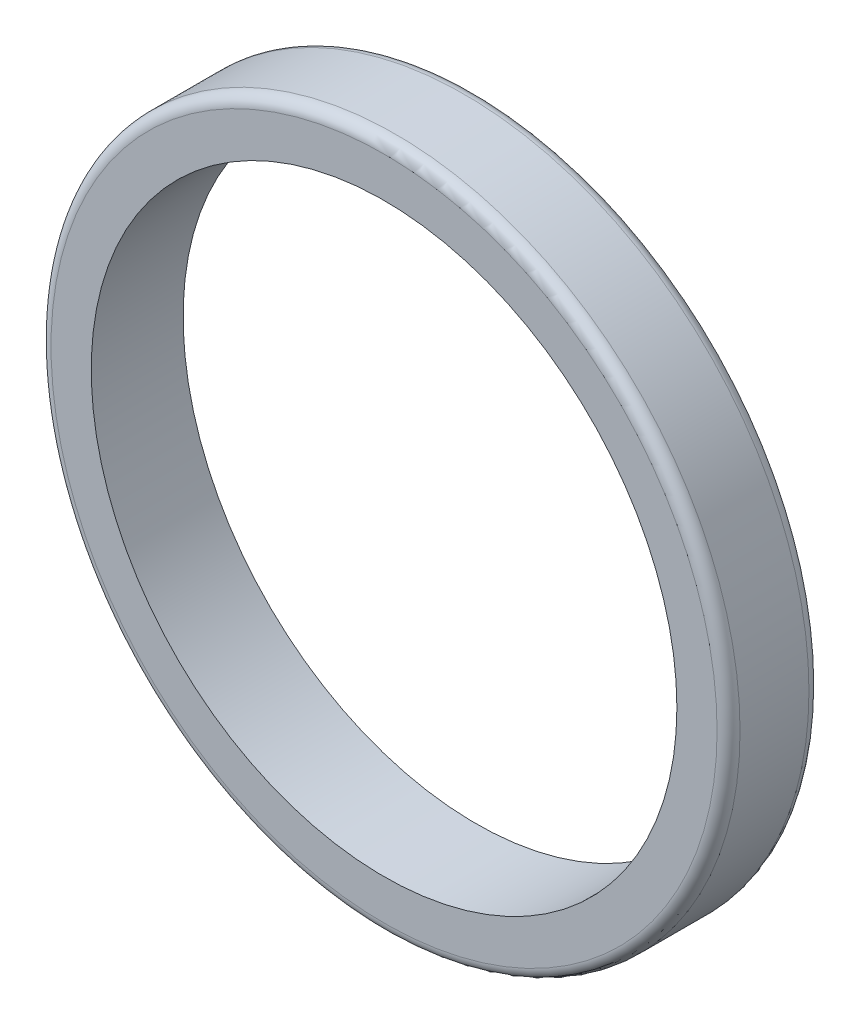
from build123d import *

# Parameters (mm, degrees)
ESQUISSE1_R             = 30
BOSS_EXTRU_1_DEPTH      = 8
ESQUISSE2_R             = 25.5
ENL_V_MAT_EXTRU_1_DEPTH = 44.17406629
CONG_1_R                = 1


with BuildPart() as part:
    # Esquisse1 → Boss.-Extru.1 (new body)
    with BuildSketch(Plane.XY):
        Circle(ESQUISSE1_R)
    extrude(amount=BOSS_EXTRU_1_DEPTH)

    # Esquisse2 → Enlèv. mat.-Extru.1 (cut, through all)
    with BuildSketch(Plane.XY.offset(8)):
        Circle(ESQUISSE2_R)
    extrude(amount=-ENL_V_MAT_EXTRU_1_DEPTH, mode=Mode.SUBTRACT)

    # Congé1
    cong_1_edges = [part.edges().sort_by_distance(p)[0] for p in [
        (-30, 0, 0),
        (-30, 0, 8),
    ]]
    fillet(cong_1_edges, radius=CONG_1_R)


solid = part.part
